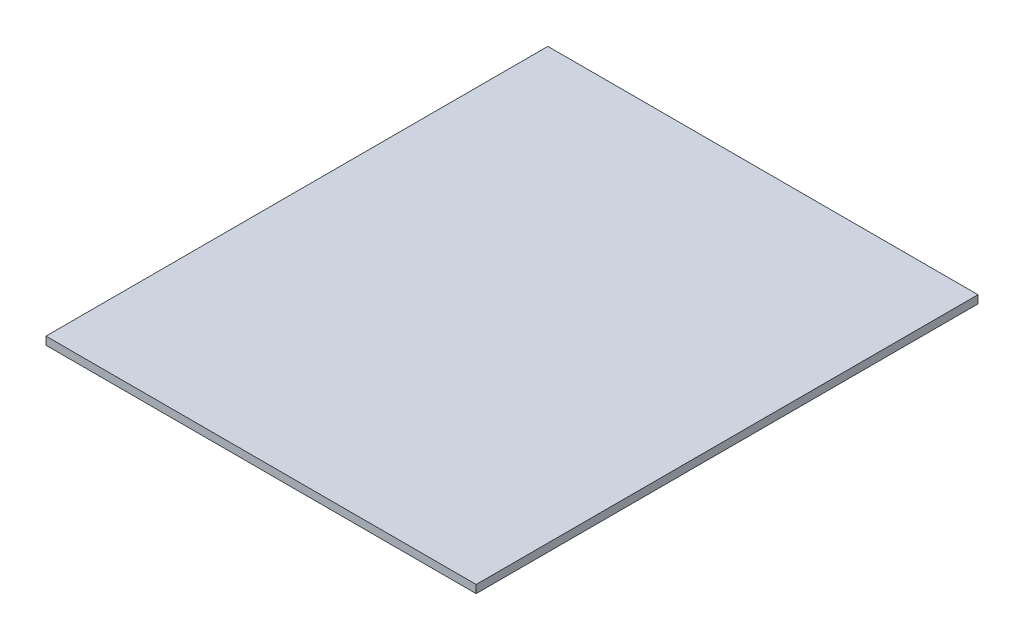
from build123d import *

# Parameters (mm, degrees)
SKETCH1_W           = 540
SKETCH1_H           = 630
BOSS_EXTRUDE1_DEPTH = 10


with BuildPart() as part:
    # Sketch1 → Boss-Extrude1 (new body)
    with BuildSketch(Plane(origin=(0, 0, 0), x_dir=(1, 0, 0), z_dir=(0, 1, 0))):
        Rectangle(SKETCH1_W, SKETCH1_H)
    extrude(amount=BOSS_EXTRUDE1_DEPTH)


solid = part.part
